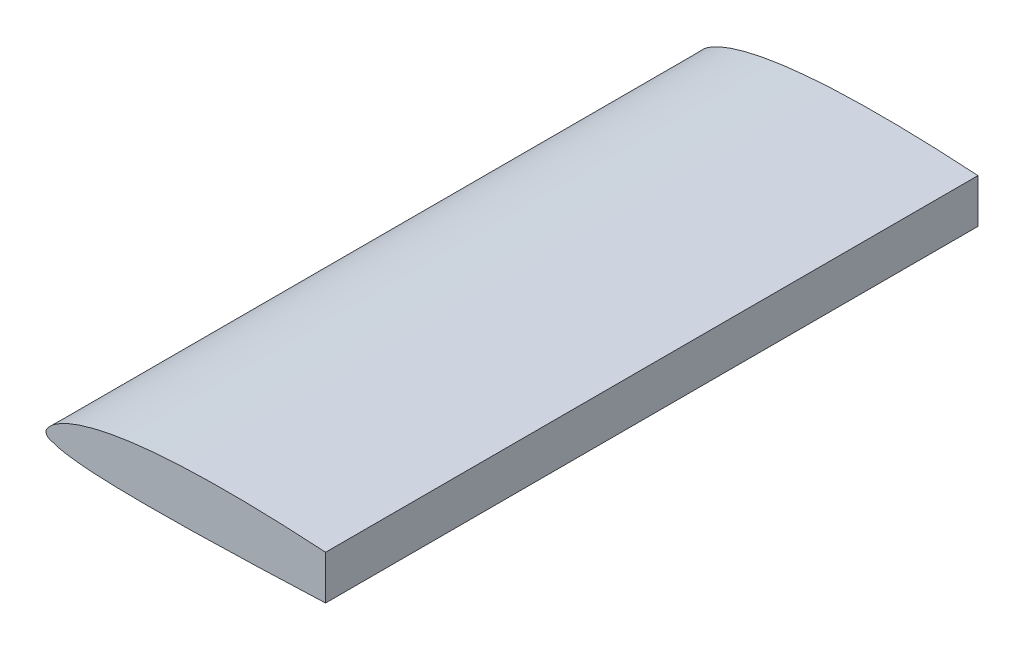
from build123d import *

# Parameters (mm, degrees)
BOSS_EXTRUDE1_DEPTH = 177.8
CUT_EXTRUDE1_REACH  = 236.418


with BuildPart() as part:
    # Sketch1 → Boss-Extrude1 (new body)
    with BuildSketch(Plane.XY):
        with BuildLine():
            Line((151.898604, 0.02286), (152.4, 0))
            add(Edge.make_bspline(
                [(152.4, 0), (152.232833718, 0.018502415), (151.571843934, 0.091662545), (150.113999557, 0.2838596), (147.749385864, 0.638650629), (144.555943786, 1.170157002), (140.615360499, 1.859099247), (136.007834995, 2.67146013), (130.806388019, 3.562840017), (125.073826155, 4.486154777), (118.864690135, 5.397753278), (112.233312125, 6.272974236), (105.243489487, 7.106058892), (97.969665406, 7.889319693), (90.492724993, 8.606734858), (82.895253241, 9.240670251), (75.258667902, 9.77749908), (67.662928423, 10.198815718), (60.186827499, 10.49170102), (52.905945954, 10.645080099), (45.891743713, 10.644551806), (39.210681048, 10.486247597), (32.923263797, 10.164412711), (27.083700854, 9.670939726), (21.73719754, 9.016508091), (16.924344759, 8.204081974), (12.676275305, 7.249770479), (9.019815693, 6.174457771), (5.965694819, 5.002018522), (3.544032537, 3.769871526), (1.704834708, 2.531499726), (0.575239506, 1.344737529), (-0.170728015, 0.20310696), (0.337603285, -1.001772228), (1.792943226, -1.546726795), (3.794232235, -2.17716446), (6.643400201, -2.643922316), (10.216110654, -3.041953632), (14.530084187, -3.319872228), (19.533969629, -3.497677255), (25.18692206, -3.577638345), (31.428627275, -3.573848082), (38.191948203, -3.496581442), (45.401595317, -3.349308986), (52.97841726, -3.141841288), (60.83867414, -2.885262261), (68.894988424, -2.587930905), (77.057432025, -2.258882887), (85.235009672, -1.907730283), (93.335426834, -1.550168819), (101.266049649, -1.195465221), (108.93417081, -0.862411006), (116.2464986, -0.557504045), (123.110150899, -0.306936183), (129.431690533, -0.107922528), (135.123521438, 0.027974451), (140.103603919, 0.108900525), (144.29941542, 0.13993859), (147.644768246, 0.124243061), (150.083437285, 0.086502888), (151.399782071, 0.04034956), (151.898604, 0.02286)],
                knots=[0, 0, 0, 0, 0.001635356, 0.006466337, 0.014296592, 0.024884209, 0.037943993, 0.053194137, 0.070376569, 0.089257218, 0.109651763, 0.131396199, 0.15429467, 0.178096903, 0.202530723, 0.227328973, 0.252225807, 0.276966075, 0.301296827, 0.324972089, 0.347773046, 0.369493849, 0.389946985, 0.408979416, 0.42646579, 0.442306729, 0.45642124, 0.468773538, 0.47934515, 0.488155641, 0.495223141, 0.500608248, 0.504417036, 0.507344225, 0.511892731, 0.518766333, 0.5280624, 0.539750485, 0.553781924, 0.570059197, 0.588441486, 0.608747967, 0.630750044, 0.65420771, 0.678865071, 0.70445057, 0.730677503, 0.757253937, 0.783882587, 0.810265561, 0.836095192, 0.861073222, 0.884896986, 0.907258357, 0.92785625, 0.946394646, 0.962618154, 0.976286171, 0.987192828, 0.99514679, 1, 1, 1, 1], degree=3))
        make_face()
    extrude(amount=BOSS_EXTRUDE1_DEPTH)

    # Sketch3 → Cut-Extrude1 (cut, up to next)
    with BuildSketch(Plane.XY.offset(177.8), mode=Mode.PRIVATE) as cut_extrude1_sk1:
        with BuildLine():
            add(Edge.make_bspline(
                [(152.329043318, 0.007856204), (152.185531128, 0.023755853), (151.548249147, 0.094773199), (150.113999557, 0.2838596), (147.749385864, 0.638650629), (144.555943786, 1.170157002), (140.615360499, 1.859099247), (136.007834995, 2.67146013), (130.806388019, 3.562840017), (125.073826155, 4.486154777), (118.864690135, 5.397753278), (112.233312125, 6.272974236), (105.243489487, 7.106058892), (97.969665406, 7.889319693), (90.492724993, 8.606734858), (83.214331559, 9.214046257), (78.435640398, 9.553904805), (76.2, 9.698555773)],
                knots=[0.000231386, 0.000231386, 0.000231386, 0.000231386, 0.001635356, 0.006466337, 0.014296592, 0.024884209, 0.037943993, 0.053194137, 0.070376569, 0.089257218, 0.109651763, 0.131396199, 0.15429467, 0.178096903, 0.202530723, 0.227328973, 0.249112544, 0.249112544, 0.249112544, 0.249112544], degree=3))
            Line((76.2, 9.698555773), (76.2, -2.290863726))
            add(Edge.make_bspline(
                [(76.2, -2.290863726), (76.483973648, -2.279122007), (79.504174025, -2.153817566), (85.235009672, -1.907730283), (93.335426834, -1.550168819), (101.266049649, -1.195465221), (108.93417081, -0.862411006), (116.2464986, -0.557504045), (123.110150899, -0.306936183), (129.431690533, -0.107922528), (135.123521438, 0.027974451), (140.103603919, 0.108900525), (144.29941542, 0.13993859), (147.644768246, 0.124243061), (150.083437285, 0.086502888), (151.399782071, 0.04034956), (151.898604, 0.02286)],
                knots=[0.754490355, 0.754490355, 0.754490355, 0.754490355, 0.757253937, 0.783882587, 0.810265561, 0.836095192, 0.861073222, 0.884896986, 0.907258357, 0.92785625, 0.946394646, 0.962618154, 0.976286171, 0.987192828, 0.99514679, 1, 1, 1, 1], degree=3))
            add(Edge.make_bspline(
                [(151.898604, 0.02286), (152.042082962, 0.017829379), (152.185561923, 0.012798758), (152.329043318, 0.007856204)],
                knots=[1, 1, 1, 1, 1.001395956, 1.001395956, 1.001395956, 1.001395956], degree=3))
        make_face()
    cut_extrude1_tool1 = extrude(cut_extrude1_sk1.sketch, amount=-CUT_EXTRUDE1_REACH, mode=Mode.PRIVATE) & part.part
    # Sketch3 → Cut-Extrude1 (cut, up to next)
    with BuildSketch(Plane.XY.offset(177.8), mode=Mode.PRIVATE) as cut_extrude1_sk2:
        with BuildLine():
            Line((151.898604, 0.02286), (152.4, 0))
            add(Edge.make_bspline(
                [(152.4, 0), (152.376347675, 0.002617903), (152.352695351, 0.005235806), (152.329043318, 0.007856204)],
                knots=[0, 0, 0, 0, 0.000231386, 0.000231386, 0.000231386, 0.000231386], degree=3))
            add(Edge.make_bspline(
                [(151.898604, 0.02286), (152.042082962, 0.017829379), (152.185561923, 0.012798758), (152.329043318, 0.007856204)],
                knots=[1, 1, 1, 1, 1.001395956, 1.001395956, 1.001395956, 1.001395956], degree=3))
        make_face()
    cut_extrude1_tool2 = extrude(cut_extrude1_sk2.sketch, amount=-CUT_EXTRUDE1_REACH, mode=Mode.PRIVATE) & part.part
    add(cut_extrude1_tool1.solids().sort_by_distance((101.677273, 2.999273, 177.8))[0], mode=Mode.SUBTRACT)
    add(cut_extrude1_tool2.solids().sort_by_distance((152.209879, 0.010201, 177.8))[0], mode=Mode.SUBTRACT)


solid = part.part
